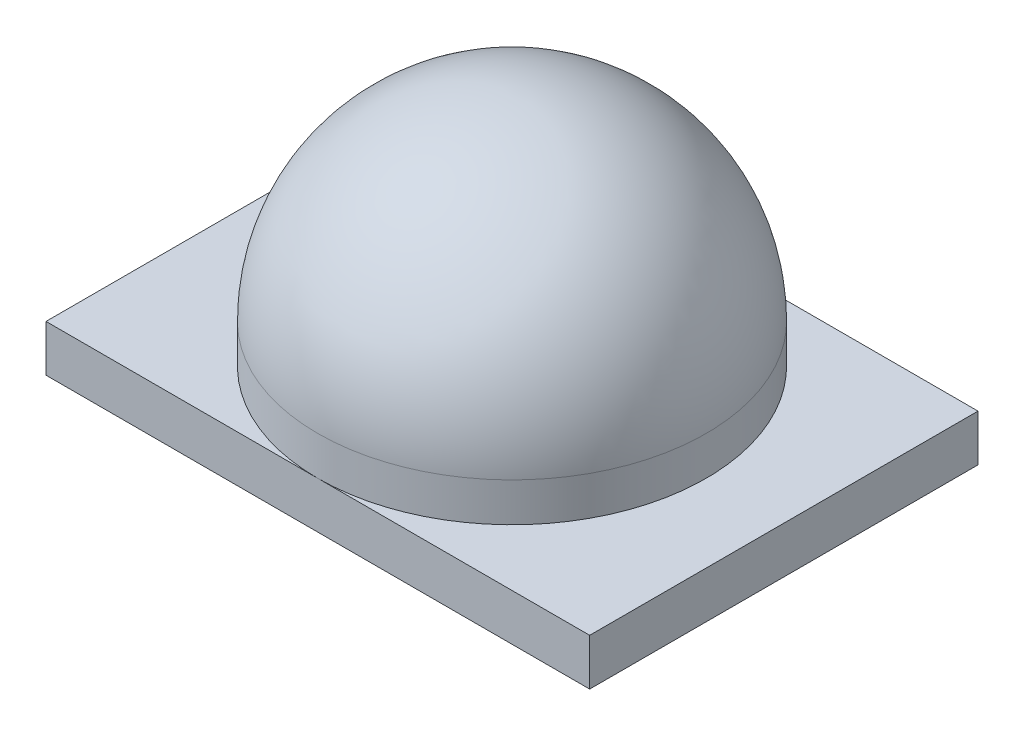
from build123d import *

# Parameters (mm, degrees)
CROQUIS3_W              = 35
CROQUIS3_H              = 25
SALIENTE_EXTRUIR1_DEPTH = 3
CROQUIS4_R              = 12.5
SALIENTE_EXTRUIR2_DEPTH = 15
REDONDEO1_R             = 12.5


with BuildPart() as part:
    # Croquis3 → Saliente-Extruir1 (new body)
    with BuildSketch(Plane(origin=(0, 0, 0), x_dir=(1, 0, 0), z_dir=(0, 1, 0))):
        Rectangle(CROQUIS3_W, CROQUIS3_H)
    extrude(amount=SALIENTE_EXTRUIR1_DEPTH)

    # Croquis4 → Saliente-Extruir2 (add)
    with BuildSketch(Plane(origin=(0, 3, 0), x_dir=(1, 0, 0), z_dir=(0, 1, 0))):
        with Locations(Location((0, 0, 0), (0, 0, 270))):
            Circle(CROQUIS4_R)
    extrude(amount=SALIENTE_EXTRUIR2_DEPTH)

    # Redondeo1
    redondeo1_edges = [part.edges().sort_by_distance(p)[0] for p in [
        (0, 18, -12.5),
    ]]
    fillet(redondeo1_edges, radius=REDONDEO1_R)


solid = part.part
